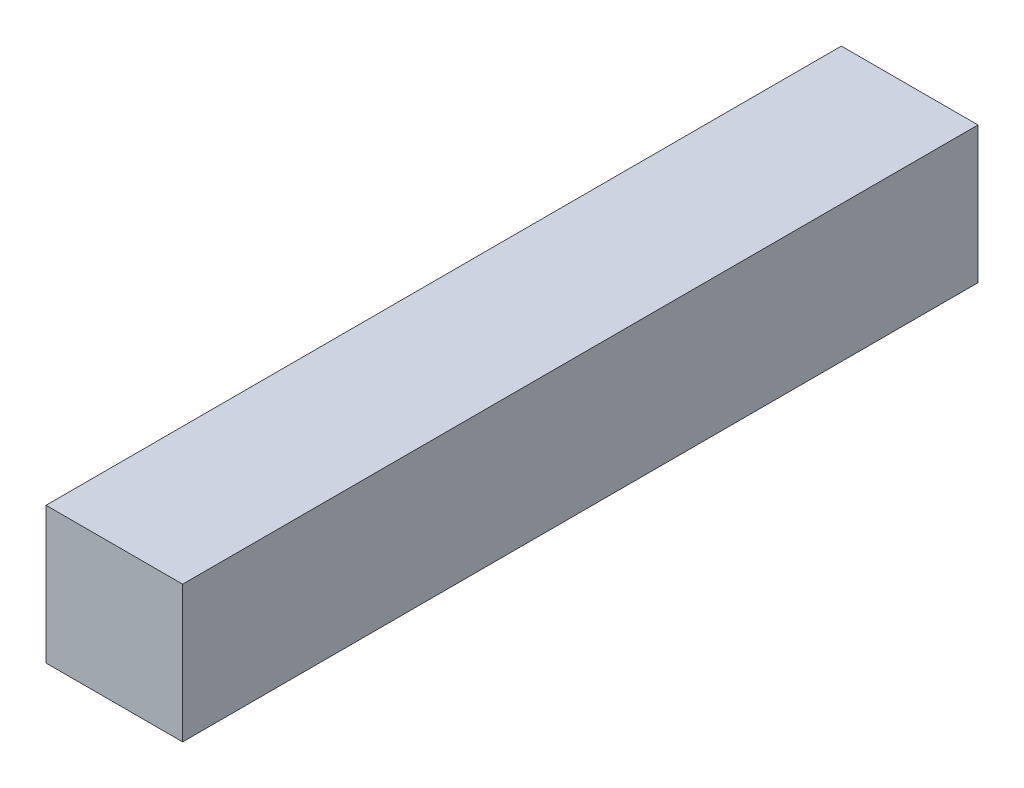
from build123d import *

# Parameters (mm, degrees)
SKETCH1_W           = 26.181720814
SKETCH1_H           = 26.181720814
BOSS_EXTRUDE1_DEPTH = 76.2


with BuildPart() as part:
    # Sketch1 → Boss-Extrude1 (new, symmetric)
    with BuildSketch(Plane.XY):
        Rectangle(SKETCH1_W, SKETCH1_H)
    extrude(amount=BOSS_EXTRUDE1_DEPTH, both=True)


solid = part.part
